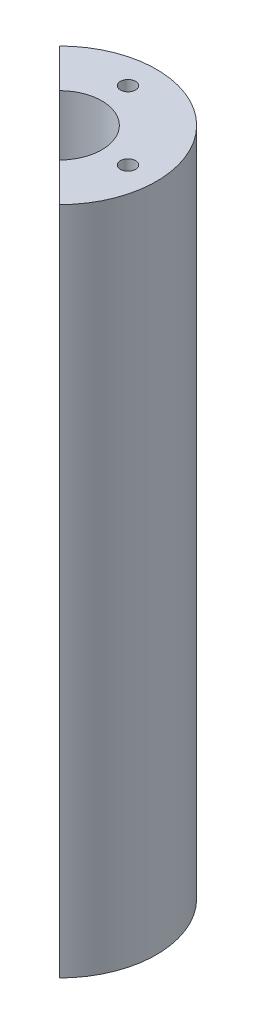
from build123d import *

# Parameters (mm, degrees)
BOSS_EXTRUDE1_DEPTH = 110.3


with BuildPart() as part:
    # Sketch1 → Boss-Extrude1 (new body)
    with BuildSketch(Plane(origin=(0, 0, 0), x_dir=(1, 0, 0), z_dir=(0, 1, 0))):
        with BuildLine():
            Line((-8, 8), (-4.949747468, 4.949747468))
            ThreePointArc((-4.949747468, 4.949747468), (2.678784027, 6.467156728), (7, 0))
            ThreePointArc((7, 0), (6.467156728, -2.678784027), (4.949747468, -4.949747468))
            Line((4.949747468, -4.949747468), (8, -8))
            ThreePointArc((8, -8), (10.197365132, -4.900382063), (11.244655102, -1.248091194))
            ThreePointArc((11.244655102, -1.248091194), (10.063708499, 0), (11.244655102, 1.248091194))
            ThreePointArc((11.244655102, 1.248091194), (8, 8), (1.248091194, 11.244655102))
            ThreePointArc((1.248091194, 11.244655102), (0, 10.063708499), (-1.248091194, 11.244655102))
            ThreePointArc((-1.248091194, 11.244655102), (-4.900382063, 10.197365132), (-8, 8))
        make_face()
        with BuildLine():
            Line((-11.313708499, 11.313708499), (-8, 8))
            ThreePointArc((-8, 8), (-4.900382063, 10.197365132), (-1.248091194, 11.244655102))
            ThreePointArc((-1.248091194, 11.244655102), (-0.034539887, 12.563231206), (1.25, 11.313708499))
            ThreePointArc((1.25, 11.313708499), (1.249522707, 11.279168612), (1.248091194, 11.244655102))
            ThreePointArc((1.248091194, 11.244655102), (8, 8), (11.244655102, 1.248091194))
            ThreePointArc((11.244655102, 1.248091194), (12.17283109, 0.907969368), (12.563708499, 0))
            ThreePointArc((12.563708499, 0), (12.17283109, -0.907969368), (11.244655102, -1.248091194))
            ThreePointArc((11.244655102, -1.248091194), (10.197365132, -4.900382063), (8, -8))
            Line((8, -8), (11.313708499, -11.313708499))
            ThreePointArc((11.313708499, -11.313708499), (14.78207252, -6.122934918), (16, 0))
            ThreePointArc((16, 0), (6.122934918, 14.78207252), (-11.313708499, 11.313708499))
        make_face()
    extrude(amount=BOSS_EXTRUDE1_DEPTH)


solid = part.part
